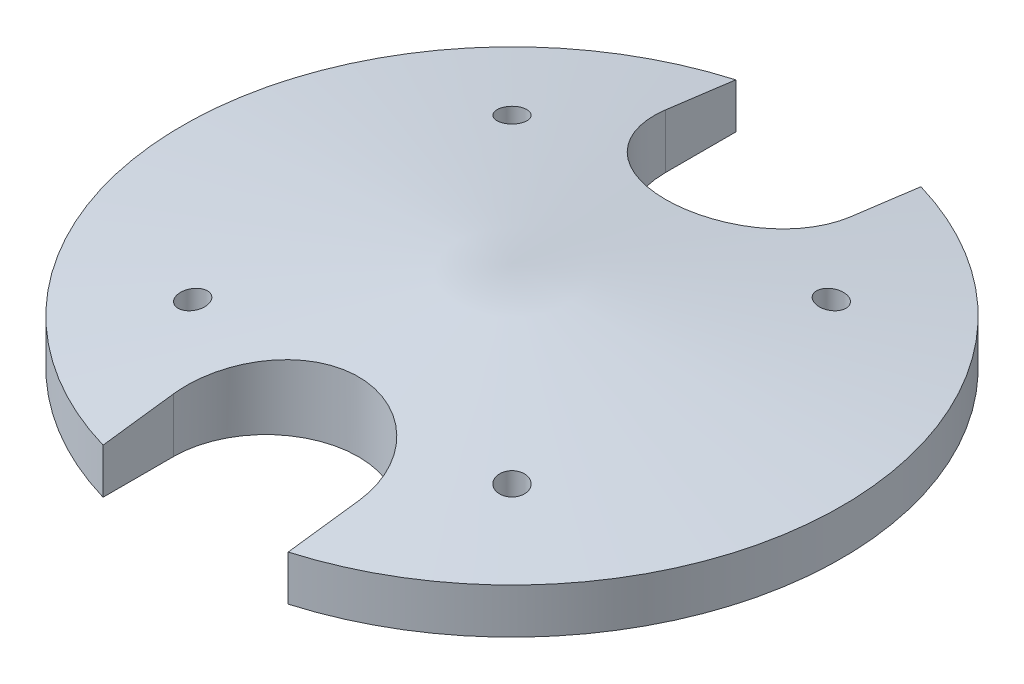
from build123d import *

# Parameters (mm, degrees)
SKETCH4_R          = 1.7
CUT_EXTRUDE1_DEPTH = 106.157025443
CUT_EXTRUDE2_DEPTH = 106.157025601
SKETCH9_R          = 3
CUT_EXTRUDE3_DEPTH = 103.287584934


with BuildPart() as part:
    # Sketch2 → Revolve1 (revolve)
    with BuildSketch(Plane(origin=(0, 0, 0), x_dir=(0, 0, -1), z_dir=(1, 0, 0))):
        Polygon((0, 0), (73, 0), (73, 10), (0, 20), align=None)
    revolve(axis=Axis((0, 10, 0), (0, 1, 0)))

    # Sketch4 → Cut-Extrude1 (cut, through all)
    with BuildSketch(Plane.XZ):
        with Locations(Location((-35.355339059, 35.355339059, 0), (0, 0, 270))):
            Circle(SKETCH4_R)
        with Locations(Location((35.355339059, 35.355339059, 0), (0, 0, 270))):
            Circle(SKETCH4_R)
        with Locations(Location((35.355339059, -35.355339059, 0), (0, 0, 270))):
            Circle(SKETCH4_R)
        with Locations(Location((-35.355339059, -35.355339059, 0), (0, 0, 270))):
            Circle(SKETCH4_R)
    extrude(amount=-CUT_EXTRUDE1_DEPTH, mode=Mode.SUBTRACT)

    # Sketch5 → Cut-Extrude2 (cut, through all)
    with BuildSketch(Plane.XZ):
        with BuildLine():
            Line((-20.5, 54.5), (-20.5, 75))
            Line((-20.5, 75), (0, 75))
            Line((0, 75), (20.5, 75))
            Line((20.5, 75), (20.5, 54.5))
            ThreePointArc((20.5, 54.5), (0, 34), (-20.5, 54.5))
        make_face()
    cut_extrude2 = extrude(amount=-CUT_EXTRUDE2_DEPTH, mode=Mode.SUBTRACT)

    # Mirror1: Cut-Extrude2 across plane
    add(cut_extrude2.mirror(Plane.XY), mode=Mode.SUBTRACT)

    # Sketch9 → Cut-Extrude3 (cut, through all)
    with BuildSketch(Plane(origin=(0, 5, 0), x_dir=(1, 0, 0), z_dir=(0, 1, 0))):
        with Locations(Location((-35.355339059, -35.355339059, 0), (0, 0, 133.431744149))):
            Circle(SKETCH9_R)
        with Locations(Location((-35.355339059, 35.355339059, 0), (0, 0, 135))):
            Circle(SKETCH9_R)
        with Locations(Location((35.355339059, 35.355339059, 0), (0, 0, 136.568255851))):
            Circle(SKETCH9_R)
        with Locations(Location((35.355339059, -35.355339059, 0), (0, 0, 135))):
            Circle(SKETCH9_R)
    extrude(amount=CUT_EXTRUDE3_DEPTH, mode=Mode.SUBTRACT)


solid = part.part
